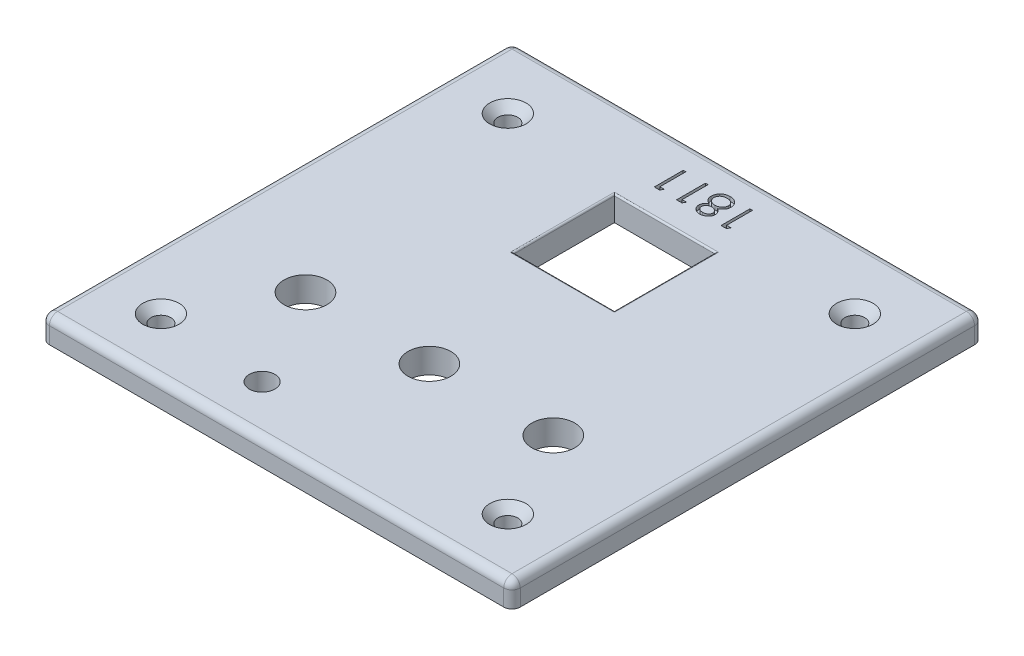
from build123d import *

# Parameters (mm, degrees)
BOSS_EXTRU_1_DEPTH                             = 3
ESQUISSE2_R                                    = 1.1499999999999997
ESQUISSE2_R_2                                  = 1.1499999999999992
ENL_V_MAT_EXTRU_1_DEPTH                        = 3
ESQUISSE3_R                                    = 1.5499999999999992
ENL_V_MAT_EXTRU_2_DEPTH                        = 3
ESQUISSE4_R                                    = 2.599999999999996
ESQUISSE4_R_2                                  = 2.6
ENL_V_MAT_EXTRU_3_DEPTH                        = 3
FRAISAGE_POUR_VIS_T_TE_FRAIS_E_M22_D           = 2.4
FRAISAGE_POUR_VIS_T_TE_FRAIS_E_M22_CSINK_D     = 4.4
FRAISAGE_POUR_VIS_T_TE_FRAIS_E_M22_CSINK_ANGLE = 90
CONG_1_R                                       = 1
CONG_2_R                                       = 1
CONG_3_R                                       = 1
CONG_4_R                                       = 1
CONG_5_R                                       = 0.2
CONG_6_R                                       = 0.2
CONG_7_R                                       = 0.2
CONG_8_R                                       = 0.2
ENL_V_MAT_EXTRU_4_DEPTH                        = 0.5


with BuildPart() as part:
    # Esquisse1 → Boss.-Extru.1 (new body)
    with BuildSketch(Plane(origin=(0, 0, 0), x_dir=(1, 0, 0), z_dir=(0, 1, 0))):
        Polygon((-29.97984930169696, 40.39898405264492), (27.020150698303052, 40.39898405264492), (27.020150698303055, -16.60101594735508), (-29.979849301696948, -16.60101594735508), align=None)
    extrude(amount=BOSS_EXTRU_1_DEPTH)

    # Esquisse2 → Enlèv. mat.-Extru.1 (cut)
    with BuildSketch(Plane(origin=(0, 3, 0), x_dir=(1, 0, 0), z_dir=(0, 1, 0))):
        with Locations(Location((19.520150698303055, -9.60101594735508, 0), (0, 0, 270))):
            Circle(ESQUISSE2_R)
        with Locations(Location((-22.47984930169696, -9.60101594735508, 0), (0, 0, 270))):
            Circle(ESQUISSE2_R)
        with Locations(Location((-22.47984930169696, 32.39898405264492, 0), (0, 0, 270))):
            Circle(ESQUISSE2_R_2)
        with Locations(Location((19.520150698303055, 32.39898405264492, 0), (0, 0, 270))):
            Circle(ESQUISSE2_R_2)
    extrude(amount=-ENL_V_MAT_EXTRU_1_DEPTH, mode=Mode.SUBTRACT)

    # Esquisse3 → Enlèv. mat.-Extru.2 (cut)
    with BuildSketch(Plane(origin=(0, 3, 0), x_dir=(1, 0, 0), z_dir=(0, 1, 0))):
        with Locations(Location((-9.229849301696957, -10.601015947355082, 0), (0, 0, 270))):
            Circle(ESQUISSE3_R)
    extrude(amount=-ENL_V_MAT_EXTRU_2_DEPTH, mode=Mode.SUBTRACT)

    # Esquisse4 → Enlèv. mat.-Extru.3 (cut)
    with BuildSketch(Plane(origin=(0, 3, 0), x_dir=(1, 0, 0), z_dir=(0, 1, 0))):
        with Locations(Location((-0.9798493016969466, 1.3989840526449187, 0), (0, 0, 270))):
            Circle(ESQUISSE4_R)
        with Locations(Location((-15.979849301696946, 1.3989840526449187, 0), (0, 0, 270))):
            Circle(ESQUISSE4_R)
        with Locations(Location((14.020150698303054, 1.3989840526449187, 0), (0, 0, 270))):
            Circle(ESQUISSE4_R_2)
        Polygon((-7.579849301696958, 30.39898405264492), (4.620150698303035, 30.39898405264492), (4.620150698303036, 18.19898405264492), (-7.579849301696957, 18.19898405264492), align=None)
    extrude(amount=-ENL_V_MAT_EXTRU_3_DEPTH, mode=Mode.SUBTRACT)

    # Fraisage pour vis à tête fraisée M22 (through all)
    with Locations(Plane(origin=(0, 3, 0), x_dir=(1, 0, 0), z_dir=(0, 1, 0))):
        with Locations((19.520150698, -9.601015947), (-22.479849302, -9.601015947), (-22.479849302, 32.398984053), (19.520150698, 32.398984053)):
            CounterSinkHole(FRAISAGE_POUR_VIS_T_TE_FRAIS_E_M22_D / 2, FRAISAGE_POUR_VIS_T_TE_FRAIS_E_M22_CSINK_D / 2, counter_sink_angle=FRAISAGE_POUR_VIS_T_TE_FRAIS_E_M22_CSINK_ANGLE)

    # Congé1
    cong_1_edges = [part.edges().sort_by_distance(p)[0] for p in [
        (-1.4798493016969445, 3, 16.60101594735508),
    ]]
    fillet(cong_1_edges, radius=CONG_1_R)

    # Congé2
    cong_2_edges = [part.edges().sort_by_distance(p)[0] for p in [
        (-29.979849301696955, 3, -12.39898405264492),
        (-29.979849301696948, 1, 16.60101594735508),
        (-29.979849301696945, 2.7071067811865475, 16.308122728541626),
    ]]
    fillet(cong_2_edges, radius=CONG_2_R)

    # Congé3
    cong_3_edges = [part.edges().sort_by_distance(p)[0] for p in [
        (27.020150698303052, 3, -12.39898405264492),
        (27.020150698303055, 1, 16.60101594735508),
        (27.020150698303055, 2.7071067811865475, 16.308122728541626),
    ]]
    fillet(cong_3_edges, radius=CONG_3_R)

    # Congé4
    cong_4_edges = [part.edges().sort_by_distance(p)[0] for p in [
        (-29.97984930169696, 1, -40.39898405264492),
        (-29.686956082883505, 2.7071067811865475, -40.39898405264492),
        (27.020150698303052, 1, -40.39898405264492),
        (-1.4798493016969516, 3, -40.39898405264492),
        (26.7272574794896, 2.7071067811865475, -40.39898405264492),
    ]]
    fillet(cong_4_edges, radius=CONG_4_R)

    # Congé5
    cong_5_edges = [part.edges().sort_by_distance(p)[0] for p in [
        (-1.4798493016969623, 3, -30.39898405264492),
    ]]
    fillet(cong_5_edges, radius=CONG_5_R)

    # Congé6
    cong_6_edges = [part.edges().sort_by_distance(p)[0] for p in [
        (-7.5798493016969575, 3, -24.39898405264492),
    ]]
    fillet(cong_6_edges, radius=CONG_6_R)

    # Congé7
    cong_7_edges = [part.edges().sort_by_distance(p)[0] for p in [
        (4.620150698303035, 3, -24.39898405264492),
    ]]
    fillet(cong_7_edges, radius=CONG_7_R)

    # Congé8
    cong_8_edges = [part.edges().sort_by_distance(p)[0] for p in [
        (-1.4798493016969605, 3, -18.19898405264492),
    ]]
    fillet(cong_8_edges, radius=CONG_8_R)

    # Esquisse10 → Enlèv. mat.-Extru.4 (cut)
    # profile 1 of 4: a face of its own
    with BuildSketch(Plane(origin=(-9.2, 3, 0), x_dir=(1, 0, 0), z_dir=(0, 1, 0))):
        Polygon((3.9400053872134384, 33.554184465979745), (3.2928699705467714, 33.554184465979745), (3.2928699705467714, 37.054184465979745), (3.6069725346493353, 37.054184465979745), (3.6069725346493353, 33.9131588249541), (4.145434073110874, 33.9131588249541), align=None)
    # profile 2 of 4: a face of its own
    with BuildSketch(Plane(origin=(-9.2, 3, 0), x_dir=(1, 0, 0), z_dir=(0, 1, 0))):
        Polygon((6.63231307952113, 33.554184465979745), (5.985177662854464, 33.554184465979745), (5.985177662854464, 37.054184465979745), (6.299280226957028, 37.054184465979745), (6.299280226957028, 33.9131588249541), (6.837741765418567, 33.9131588249541), align=None)
    # profile 3 of 4: a face of its own
    with BuildSketch(Plane(origin=(-9.2, 3, 0), x_dir=(1, 0, 0), z_dir=(0, 1, 0))):
        with BuildLine():
            add(Edge.make_bspline(
                [(8.366888400033952, 35.104364754441285), (8.338467891575391, 35.11930000926927), (8.282865023067753, 35.14851985984087), (8.203656633366403, 35.1957108299031), (8.129728173125182, 35.24372599326286), (8.062446996629797, 35.2942916855109), (8.001153479389286, 35.34633305755995), (7.945658997205475, 35.39971240517245), (7.8953667418840086, 35.454260908831316), (7.852004472389937, 35.51138090889103), (7.813530989127701, 35.57005664303068), (7.7809392287603565, 35.63101127633227), (7.752494899182112, 35.69336400386898), (7.730169644570277, 35.75806146757999), (7.711737588823516, 35.82421610919835), (7.699064764112822, 35.89271561340895), (7.692247097066102, 35.96309954406726), (7.690958386095587, 36.01066790185851), (7.690305867982669, 36.034753376236154)],
                knots=[0, 0, 0, 0, 1.2642197286755097, 2.4733633263738524, 3.6297915902495586, 4.734286946823697, 5.785533754676259, 6.794509389712753, 7.76531585102613, 8.704182021304376, 9.61557661348944, 10.525715488292464, 11.42381390533657, 12.311666436338601, 13.218214637818134, 14.126256791410492, 15.05126020455013, 16, 16, 16, 16], degree=3))
            add(Edge.make_bspline(
                [(7.690305867982669, 36.034753376236154), (7.691072964800169, 36.06845256089888), (7.6925913372289525, 36.13515589181763), (7.705954183439942, 36.233580892287144), (7.72569287488679, 36.32955863271236), (7.755677837901461, 36.422001095582296), (7.792575758862595, 36.51169590732851), (7.839136057347085, 36.59743463821879), (7.891685382087637, 36.681678452542), (7.93394608338766, 36.733494503106115), (7.9553299064442085, 36.75971331213359)],
                knots=[0, 0, 0, 0, 1.025315120448202, 2.0294833379425135, 3.0187485875323423, 4.004195107025846, 4.983200898970344, 5.966616707319841, 6.971112470942597, 8, 8, 8, 8], degree=3))
            add(Edge.make_bspline(
                [(7.9553299064442085, 36.75971331213359), (7.9831663807485125, 36.79030708632446), (8.038495346324028, 36.85111657895372), (8.13327827394018, 36.93006738894461), (8.237300157756131, 36.996416783037795), (8.35015849039483, 37.050488677586635), (8.471551591800594, 37.092574536511556), (8.601453596410911, 37.12281705442491), (8.740117749329396, 37.14013948364148), (8.835423220445124, 37.142643473340925), (8.884316284649335, 37.143928055723336)],
                knots=[0, 0, 0, 0, 0.9542676029869658, 1.8967430565490577, 2.8383683537210103, 3.796610407526805, 4.779680526519822, 5.79940923692492, 6.871065593542122, 8, 8, 8, 8], degree=3))
            add(Edge.make_bspline(
                [(8.884316284649335, 37.143928055723336), (8.93132859054884, 37.14277248498286), (9.02280976267846, 37.14052386169596), (9.155982546353787, 37.12537200957422), (9.28027120791271, 37.0985474393016), (9.396265027583214, 37.06259172854322), (9.502842380730012, 37.01464393334401), (9.600197046437343, 36.9558739333846), (9.689755934314288, 36.88760856196031), (9.768709470044547, 36.80820493741277), (9.838785087075768, 36.7231394305868), (9.900395304187386, 36.63540708088846), (9.951315954873573, 36.54507174136482), (9.995205465507281, 36.453507506440275), (10.027867778835615, 36.35885909018924), (10.051034048535444, 36.26209780137846), (10.065585697221701, 36.16349852893329), (10.067531907654635, 36.09696877966831), (10.068510996187799, 36.0634993698259)],
                knots=[0, 0, 0, 0, 1.2568642785382955, 2.445730223365541, 3.5768450884473286, 4.6518104405377, 5.686528261570841, 6.692706663908877, 7.686234615468658, 8.68914859354467, 9.678739426579448, 10.630299995568649, 11.550979609862782, 12.44820896056016, 13.341360817379357, 14.221834468928336, 15.105450545288393, 16, 16, 16, 16], degree=3))
            add(Edge.make_bspline(
                [(10.068510996187799, 36.0634993698259), (10.067932973670702, 36.03894023304908), (10.066790597158008, 35.990402710381446), (10.058887795092597, 35.918692582941134), (10.046171751861815, 35.848899409381545), (10.028940344042253, 35.78074771083339), (10.005373383055776, 35.714597087031486), (9.977414561214124, 35.650106390520605), (9.944500318086934, 35.58727748966297), (9.905334579785226, 35.52706693893443), (9.862184090548764, 35.46734193450207), (9.810960489788954, 35.41106809741219), (9.755078826461558, 35.354939980665385), (9.691212446269226, 35.30237073057287), (9.622810604121204, 35.24901738817771), (9.546683198534279, 35.19933935101481), (9.465368626785823, 35.149459486977015), (9.407560451099371, 35.1196542414861), (9.37790602823908, 35.104364754441285)],
                knots=[0, 0, 0, 0, 0.9415756216743338, 1.8608857671035597, 2.7625576282380537, 3.6601683863299357, 4.552890429296321, 5.451842039738639, 6.35373650842158, 7.268493418165326, 8.204037486833972, 9.175167801666936, 10.182660057042149, 11.238220596270805, 12.34404633472106, 13.507168086537748, 14.721227736325739, 15.999999999999998, 15.999999999999998, 15.999999999999998, 15.999999999999998], degree=3))
            add(Edge.make_bspline(
                [(9.37790602823908, 35.104364754441285), (9.418447985659537, 35.082165692904326), (9.49682580992385, 35.03924931060111), (9.601597992478114, 34.96138355715906), (9.690348890689656, 34.875522073850505), (9.762135319808896, 34.781535649542775), (9.818814340208677, 34.682513290655976), (9.858887054355167, 34.57897629751811), (9.885043430189736, 34.47207945309498), (9.887693095325254, 34.399186416517075), (9.889023816700616, 34.36257789546692)],
                knots=[0, 0, 0, 0, 1.1670103900509412, 2.2561252856499903, 3.2877522392442446, 4.277689688026067, 5.235169525066691, 6.160862735385508, 7.076343935901114, 8, 8, 8, 8], degree=3))
            add(Edge.make_bspline(
                [(9.889023816700616, 34.36257789546692), (9.887385491612667, 34.32528205817665), (9.884092172468236, 34.25031092097127), (9.857553517620401, 34.138678298486276), (9.813978445847038, 34.02897708279316), (9.755725061969658, 33.921461491852405), (9.681590431122439, 33.82103058593368), (9.593841735091155, 33.730226588626245), (9.492589353788594, 33.65139960479375), (9.380058781516182, 33.58476489418669), (9.259176512167471, 33.530272396144916), (9.131419832747154, 33.49307118605687), (8.999065680301555, 33.46860391778286), (8.908966276829048, 33.46584151436523), (8.86328263080318, 33.464440876236154)],
                knots=[0, 0, 0, 0, 0.8887245951072146, 1.7864914263488934, 2.7200838841981283, 3.6978040671238426, 4.694405760154756, 5.687697823460221, 6.700087299593226, 7.744853364422517, 8.800284130715916, 9.853047784401875, 10.911417819966312, 12, 12, 12, 12], degree=3))
            add(Edge.make_bspline(
                [(8.86328263080318, 33.464440876236154), (8.818777154915056, 33.46588097022454), (8.73101742666278, 33.46872067150974), (8.601826993210999, 33.49263847066689), (8.478110179411004, 33.53213725197883), (8.360560370717819, 33.58593473591422), (8.25167877322878, 33.65296797460418), (8.154784230332094, 33.73266244035492), (8.069085740613593, 33.822477022009494), (7.998283320135078, 33.92323916976499), (7.941484822938939, 34.03074759163989), (7.900583362882293, 34.14226931717492), (7.874725126476897, 34.25646737357121), (7.871439313981786, 34.33369887061773), (7.869793047469847, 34.37239360059513)],
                knots=[0, 0, 0, 0, 1.0726341256290304, 2.1151122980002235, 3.1560505861601835, 4.197614250338177, 5.225177188484537, 6.230426315065385, 7.215180150871028, 8.209739480720144, 9.190420595624056, 10.139012357297364, 11.06760302364363, 12, 12, 12, 12], degree=3))
            add(Edge.make_bspline(
                [(7.869793047469847, 34.37239360059513), (7.8712362863915075, 34.41036693060873), (7.8740707256042, 34.48494439246328), (7.897600500153368, 34.59350440885205), (7.937843720199416, 34.69496257217645), (7.99213195074305, 34.790880102705714), (8.063386490846433, 34.87972424481147), (8.150168644153696, 34.96193622871158), (8.251352312642922, 35.03912394925917), (8.327515506790318, 35.08213170747241), (8.366888400033952, 35.104364754441285)],
                knots=[0, 0, 0, 0, 0.975463757878233, 1.9157553779873644, 2.8383590755649997, 3.7720255861804173, 4.738400887667783, 5.753889765461902, 6.838863581446483, 8, 8, 8, 8], degree=3))
        make_face()
        with BuildLine():
            add(Edge.make_bspline(
                [(8.880810675674978, 33.82341523521051), (8.905362339510953, 33.82406456695295), (8.953396129182382, 33.825334943761284), (9.023812782756092, 33.832023119331), (9.090828389351774, 33.84487005593333), (9.15480941651998, 33.86247018600295), (9.215975038735717, 33.88436827411345), (9.272922618880875, 33.91321975149774), (9.327565921195236, 33.945288288756245), (9.378112321553157, 33.98290322288552), (9.42386964789292, 34.02394192924771), (9.464739007012918, 34.066800394524044), (9.498034850533603, 34.112742066258434), (9.526680485538911, 34.159468544179944), (9.547953870741114, 34.208917925599955), (9.563065749883414, 34.260007500981466), (9.573760544462715, 34.313060868222124), (9.574531342837043, 34.349203122766966), (9.574921252598054, 34.36748574803103)],
                knots=[0, 0, 0, 0, 1.2035374695761851, 2.354645536918867, 3.4621308884289954, 4.54305886180998, 5.6048224229094235, 6.639552563106514, 7.666902585975227, 8.706944257759059, 9.720926464480488, 10.677177238656277, 11.602682186798308, 12.496457588119496, 13.358248655346191, 14.231532793995314, 15.105417644074809, 16, 16, 16, 16], degree=3))
            add(Edge.make_bspline(
                [(9.574921252598054, 34.36748574803103), (9.57421014812635, 34.385758021309336), (9.57280490353432, 34.42186665826796), (9.562633696237958, 34.47540275194351), (9.5456273519108, 34.52732760553359), (9.522307996562791, 34.578125949844875), (9.492381970466589, 34.627667395617365), (9.456060710997011, 34.676141783337215), (9.411768248501486, 34.72226724599056), (9.362856003808831, 34.76735245240694), (9.30942803172795, 34.80889011986461), (9.253284952122467, 34.84599383793822), (9.194017029160426, 34.87557259529692), (9.133399199293875, 34.901507120504064), (9.070149538667422, 34.92096102181695), (9.00470415881849, 34.9349764114754), (8.93713296875238, 34.94364580434151), (8.891353164583629, 34.94468454655123), (8.868190483367286, 34.94521010700539)],
                knots=[0, 0, 0, 0, 0.8732131659175622, 1.7255946600275014, 2.594724522841017, 3.479581045048849, 4.39159756869265, 5.356870480003082, 6.3685480907548735, 7.4439761425319295, 8.534559525403898, 9.600545123281112, 10.654815914616682, 11.696401764838445, 12.749428718182674, 13.812189468435792, 14.893058657097335, 16, 16, 16, 16], degree=3))
            add(Edge.make_bspline(
                [(8.868190483367286, 34.94521010700539), (8.838438598342778, 34.94434164158902), (8.779228685837165, 34.94261328853593), (8.69197569402802, 34.92639702453006), (8.606924184798997, 34.901211633709494), (8.525683479259516, 34.865465522936454), (8.449707594435015, 34.821882425039604), (8.381139363426408, 34.77048575493915), (8.322848239427035, 34.71006850218074), (8.273257327353026, 34.64413532441877), (8.234484254553811, 34.57419615168536), (8.204783473613364, 34.50372322081133), (8.18729233531109, 34.43213605021901), (8.185018630714321, 34.38416714244738), (8.183895611572412, 34.36047453008231)],
                knots=[0, 0, 0, 0, 1.0765614489635151, 2.1424897665321723, 3.202892658301009, 4.2831741875310225, 5.348766409137506, 6.369549038778205, 7.37509393247063, 8.378927501887075, 9.349008456529752, 10.263787949681088, 11.142457041389841, 12, 12, 12, 12], degree=3))
            add(Edge.make_bspline(
                [(8.183895611572412, 34.36047453008231), (8.184417671147777, 34.343843007097526), (8.185453884576301, 34.31083181782546), (8.194338792858138, 34.261923568305114), (8.208196536846062, 34.21409747200155), (8.228396157342685, 34.16763429115987), (8.252831409832936, 34.121454643485336), (8.283978420088232, 34.07700722714344), (8.320076027266532, 34.03294693927624), (8.361645353210717, 33.99072404684691), (8.408610117137783, 33.95108406165149), (8.461350228402877, 33.9167224038683), (8.519400272546223, 33.888068604325866), (8.581981997482824, 33.86399587186867), (8.64975675788866, 33.84611685125605), (8.722141027574327, 33.83266223944739), (8.799787934460612, 33.82509434930986), (8.853217334714211, 33.823987079203455), (8.880810675674978, 33.82341523521051)],
                knots=[0, 0, 0, 0, 0.814035228222231, 1.6157432495844892, 2.42711809311958, 3.247806469651863, 4.09288092496243, 4.981933387974257, 5.900917882526943, 6.8803671064447, 7.879945009748598, 8.905470124901262, 9.954929380010265, 11.045535400369818, 12.184050452870725, 13.38299759497883, 14.648462469836051, 16, 16, 16, 16], degree=3))
        make_face(mode=Mode.SUBTRACT)
        with BuildLine():
            add(Edge.make_bspline(
                [(8.860478143623695, 35.304184465979745), (8.89160384380168, 35.30473826549635), (8.95266487276399, 35.30582468501878), (9.042123009458765, 35.3179119468831), (9.127971775541347, 35.3347494888804), (9.20994763169245, 35.36025083963232), (9.287629783505874, 35.3934315623298), (9.362111465791635, 35.43277821583246), (9.432226316170178, 35.4799390673174), (9.497660944358074, 35.533770518101335), (9.557568103647293, 35.59210636696941), (9.610317194217838, 35.653716816112414), (9.654882697013967, 35.71776527216999), (9.69104810213683, 35.78433274674843), (9.719104266263999, 35.85327257113726), (9.73981014881504, 35.92462497695073), (9.751831956792993, 35.99858899122463), (9.753544818517534, 36.04873361078334), (9.754408432085233, 36.07401619674898)],
                knots=[0, 0, 0, 0, 1.140332253345041, 2.237053635741608, 3.304055027666444, 4.3446902942865275, 5.3774657188889075, 6.397042764538333, 7.4283600437344415, 8.469453732242382, 9.499453352124226, 10.490108611691527, 11.43839852765555, 12.354680513798419, 13.261581006952218, 14.161901134599665, 15.073242693098667, 15.999999999999998, 15.999999999999998, 15.999999999999998, 15.999999999999998], degree=3))
            add(Edge.make_bspline(
                [(9.754408432085233, 36.07401619674898), (9.753019981437518, 36.10544161146818), (9.75025524469406, 36.16801711524684), (9.729108263677867, 36.26026451858233), (9.694378808072859, 36.349543621716535), (9.645657475854135, 36.43459528180023), (9.586228842135162, 36.51438828586769), (9.513981745726559, 36.58492025537923), (9.430677647201367, 36.64524172203029), (9.33700092912255, 36.69565809331031), (9.23431290420391, 36.73558854268442), (9.123248165844803, 36.76415605426282), (9.004559028999408, 36.78211194247308), (8.922710174468103, 36.783991517643926), (8.880810675674978, 36.78495369674897)],
                knots=[0, 0, 0, 0, 0.899105568066841, 1.7903338547706629, 2.6949250788274326, 3.632758986534913, 4.588257081274028, 5.534574045661757, 6.511571684992103, 7.523527334176443, 8.572244310792952, 9.657983074953078, 10.801090914632788, 11.999999999999998, 11.999999999999998, 11.999999999999998, 11.999999999999998], degree=3))
            add(Edge.make_bspline(
                [(8.880810675674978, 36.78495369674897), (8.848062578183253, 36.784317544824546), (8.784258782785676, 36.78307811687799), (8.691141392339247, 36.77236551733346), (8.603473678677512, 36.75486673607476), (8.520415757673366, 36.73114026497795), (8.44258584788341, 36.699688747796884), (8.370090033790392, 36.66062294851147), (8.301941120889342, 36.616001362354595), (8.241051662204509, 36.5631732634614), (8.185688174304698, 36.50664392971649), (8.137194123082335, 36.44711667270531), (8.096153242164986, 36.38518766252997), (8.063070349856527, 36.32089314947904), (8.036799373212983, 36.25446941121487), (8.017860990095375, 36.18564377811855), (8.00618873059419, 36.11414590998068), (8.005007295125962, 36.065647198422), (8.004408432085233, 36.04106347239)],
                knots=[0, 0, 0, 0, 1.2246319017384566, 2.3859756529556133, 3.5003405382459953, 4.565441647304189, 5.612488580752684, 6.633222109943898, 7.641830067838287, 8.65259507363689, 9.641693810780804, 10.598750961825743, 11.520088299388377, 12.415429315073856, 13.298523938131245, 14.187139573831315, 15.081071174493708, 16, 16, 16, 16], degree=3))
            add(Edge.make_bspline(
                [(8.004408432085233, 36.04106347239), (8.005308295961658, 36.01718341296726), (8.007082670333974, 35.97009610725455), (8.018506158616383, 35.90036901244567), (8.038116510920457, 35.83272782383439), (8.066711710964936, 35.76747761886389), (8.101828068715324, 35.70385936913625), (8.14520797617735, 35.64240715823948), (8.196322718542586, 35.582950828026554), (8.255047184278695, 35.52671452008078), (8.318691242738213, 35.474726606067605), (8.38614004881651, 35.42852607998548), (8.457700987851622, 35.39076596702229), (8.531956466678624, 35.35904481319317), (8.609655045199956, 35.33432431508302), (8.690421957957046, 35.31698997781443), (8.774410213071096, 35.30609535818545), (8.831464714756619, 35.30482862617654), (8.860478143623695, 35.304184465979745)],
                knots=[0, 0, 0, 0, 0.9173363843642073, 1.808827105800716, 2.706624560792692, 3.615530866699858, 4.53986992051147, 5.493819324329412, 6.499753196508219, 7.547410123139145, 8.613069607529296, 9.653934020967695, 10.682176707500552, 11.716048073918543, 12.752411263166534, 13.808993382177277, 14.885826485631753, 16, 16, 16, 16], degree=3))
        make_face(mode=Mode.SUBTRACT)
    # profile 4 of 4: a face of its own
    with BuildSketch(Plane(origin=(-9.2, 3, 0), x_dir=(1, 0, 0), z_dir=(0, 1, 0))):
        Polygon((12.016928464136516, 33.554184465979745), (11.369793047469848, 33.554184465979745), (11.369793047469848, 37.054184465979745), (11.683895611572414, 37.054184465979745), (11.683895611572414, 33.9131588249541), (12.22235715003395, 33.9131588249541), align=None)
    extrude(amount=-ENL_V_MAT_EXTRU_4_DEPTH, mode=Mode.SUBTRACT)


solid = part.part
